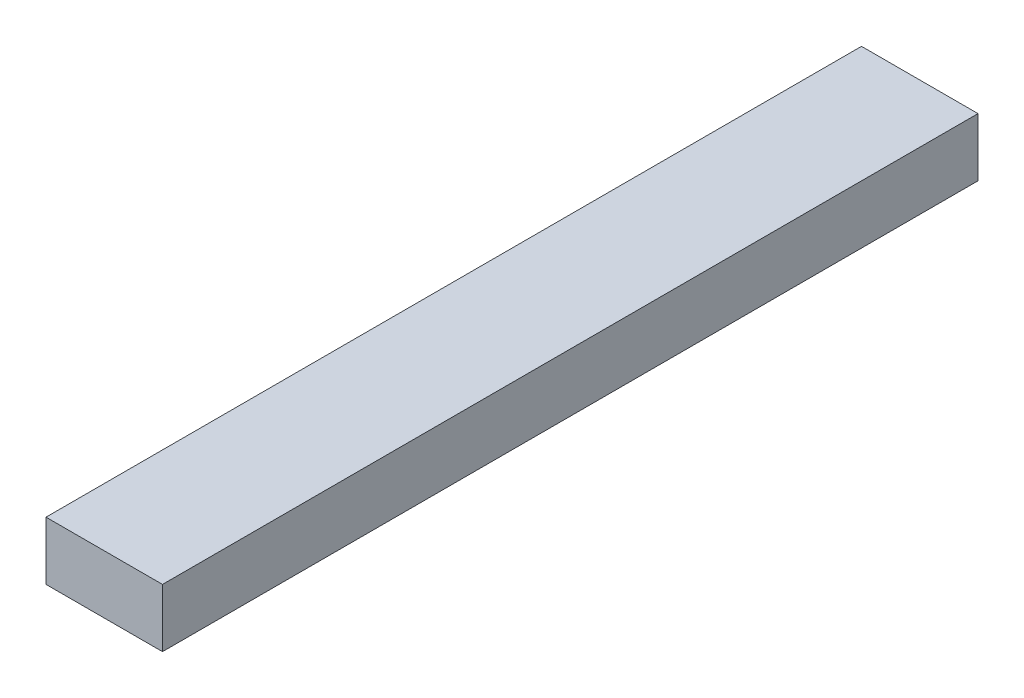
from build123d import *

# Parameters (mm, degrees)
SKETCH1_W           = 101.6
SKETCH1_H           = 50.8
BOSS_EXTRUDE1_DEPTH = 914.4
SKETCH2_W           = 101.6
SKETCH2_H           = 50.8
CUT_EXTRUDE1_DEPTH  = 101.6
SKETCH3_W           = 101.6
SKETCH3_H           = 101.6
CUT_EXTRUDE2_DEPTH  = 50.8


with BuildPart() as part:
    # Sketch1 → Boss-Extrude1 (new body)
    with BuildSketch(Plane.XY):
        Rectangle(SKETCH1_W, SKETCH1_H)
    extrude(amount=BOSS_EXTRUDE1_DEPTH)

    # Sketch2 → Cut-Extrude1 (cut)
    with BuildSketch(Plane(origin=(0, 0, 0), x_dir=(-1, 0, 0), z_dir=(0, 0, -1))):
        Rectangle(SKETCH2_W, SKETCH2_H)
    extrude(amount=-CUT_EXTRUDE1_DEPTH, mode=Mode.SUBTRACT)

    # Sketch3 → Cut-Extrude2 (cut)
    with BuildSketch(Plane(origin=(0, 25.4, 0), x_dir=(1, 0, 0), z_dir=(0, 1, 0))):
        with Locations((0, -863.6)):
            Rectangle(SKETCH3_W, SKETCH3_H)
    extrude(amount=-CUT_EXTRUDE2_DEPTH, mode=Mode.SUBTRACT)


solid = part.part
